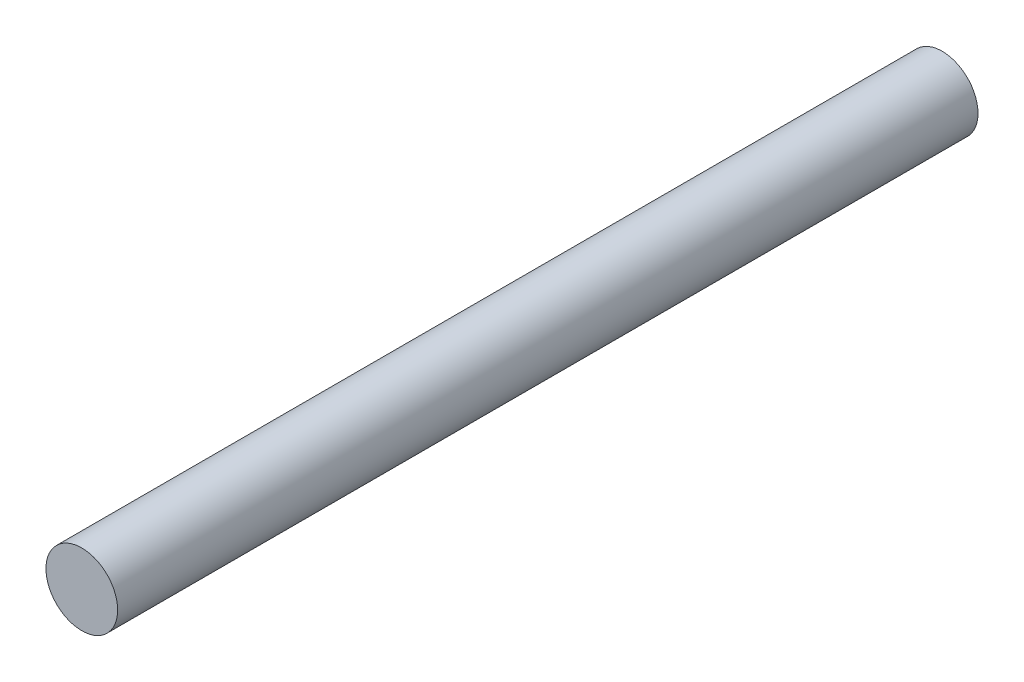
from build123d import *

# Parameters (mm, degrees)
CROQUIS1_R              = 2.5
SALIENTE_EXTRUIR1_DEPTH = 60


with BuildPart() as part:
    # Croquis1 → Saliente-Extruir1 (new body)
    with BuildSketch(Plane.XY):
        Circle(CROQUIS1_R)
    extrude(amount=SALIENTE_EXTRUIR1_DEPTH)


solid = part.part
